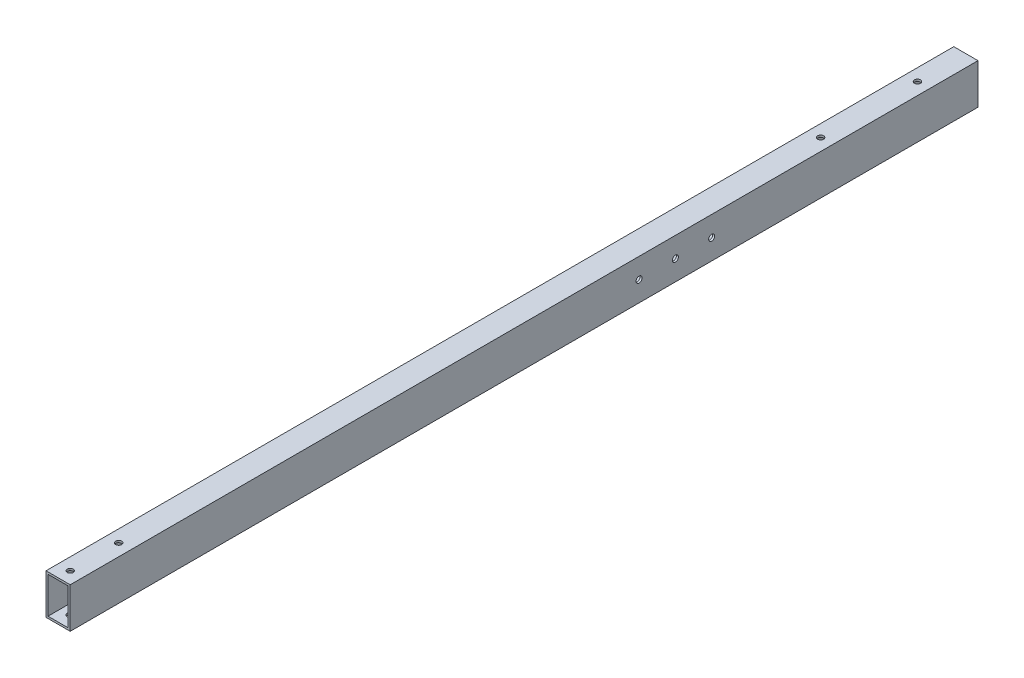
from build123d import *

# Parameters (mm, degrees)
SKETCH1_W           = 12
SKETCH1_H           = 20
SKETCH1_W_2         = 10
SKETCH1_H_2         = 18
BOSS_EXTRUDE1_DEPTH = 450
CUT_EXTRUDE1_REACH  = 452.271
SKETCH2_R           = 1.5
SKETCH3_R           = 1.5
CUT_EXTRUDE2_DEPTH  = 451.484183962


with BuildPart() as part:
    # Sketch1 → Boss-Extrude1 (new body)
    with BuildSketch(Plane.XY):
        Rectangle(SKETCH1_W, SKETCH1_H)
        Rectangle(SKETCH1_W_2, SKETCH1_H_2, mode=Mode.SUBTRACT)
    extrude(amount=BOSS_EXTRUDE1_DEPTH)

    # Sketch2 → Cut-Extrude1 (cut, up to next)
    with BuildSketch(Plane(origin=(6, 0, 0), x_dir=(0, 0, -1), z_dir=(1, 0, 0)), mode=Mode.PRIVATE) as cut_extrude1_sk1:
        with Locations((-168, 0)):
            Circle(SKETCH2_R)
    cut_extrude1_tool1 = extrude(cut_extrude1_sk1.sketch, amount=-CUT_EXTRUDE1_REACH, mode=Mode.PRIVATE) & part.part
    # Sketch2 → Cut-Extrude1 (cut, up to next)
    with BuildSketch(Plane(origin=(6, 0, 0), x_dir=(0, 0, -1), z_dir=(1, 0, 0)), mode=Mode.PRIVATE) as cut_extrude1_sk2:
        with Locations((-150, 0)):
            Circle(SKETCH2_R)
    cut_extrude1_tool2 = extrude(cut_extrude1_sk2.sketch, amount=-CUT_EXTRUDE1_REACH, mode=Mode.PRIVATE) & part.part
    # Sketch2 → Cut-Extrude1 (cut, up to next)
    with BuildSketch(Plane(origin=(6, 0, 0), x_dir=(0, 0, -1), z_dir=(1, 0, 0)), mode=Mode.PRIVATE) as cut_extrude1_sk3:
        with Locations((-132, 0)):
            Circle(SKETCH2_R)
    cut_extrude1_tool3 = extrude(cut_extrude1_sk3.sketch, amount=-CUT_EXTRUDE1_REACH, mode=Mode.PRIVATE) & part.part
    add(cut_extrude1_tool1.solids().sort_by_distance((6, 0, 168))[0], mode=Mode.SUBTRACT)
    add(cut_extrude1_tool2.solids().sort_by_distance((6, 0, 150))[0], mode=Mode.SUBTRACT)
    add(cut_extrude1_tool3.solids().sort_by_distance((6, 0, 132))[0], mode=Mode.SUBTRACT)

    # Sketch3 → Cut-Extrude2 (cut, through all)
    with BuildSketch(Plane(origin=(0, 10, 0), x_dir=(1, 0, 0), z_dir=(0, 1, 0))):
        with Locations(Location((0, -444, 0), (0, 0, 270))):
            Circle(SKETCH3_R)
        with Locations(Location((0, -420, 0), (0, 0, 270))):
            Circle(SKETCH3_R)
        with Locations(Location((0, -24, 0), (0, 0, 270))):
            Circle(SKETCH3_R)
        with Locations(Location((0, -72, 0), (0, 0, 270))):
            Circle(SKETCH3_R)
    extrude(amount=-CUT_EXTRUDE2_DEPTH, mode=Mode.SUBTRACT)


solid = part.part
